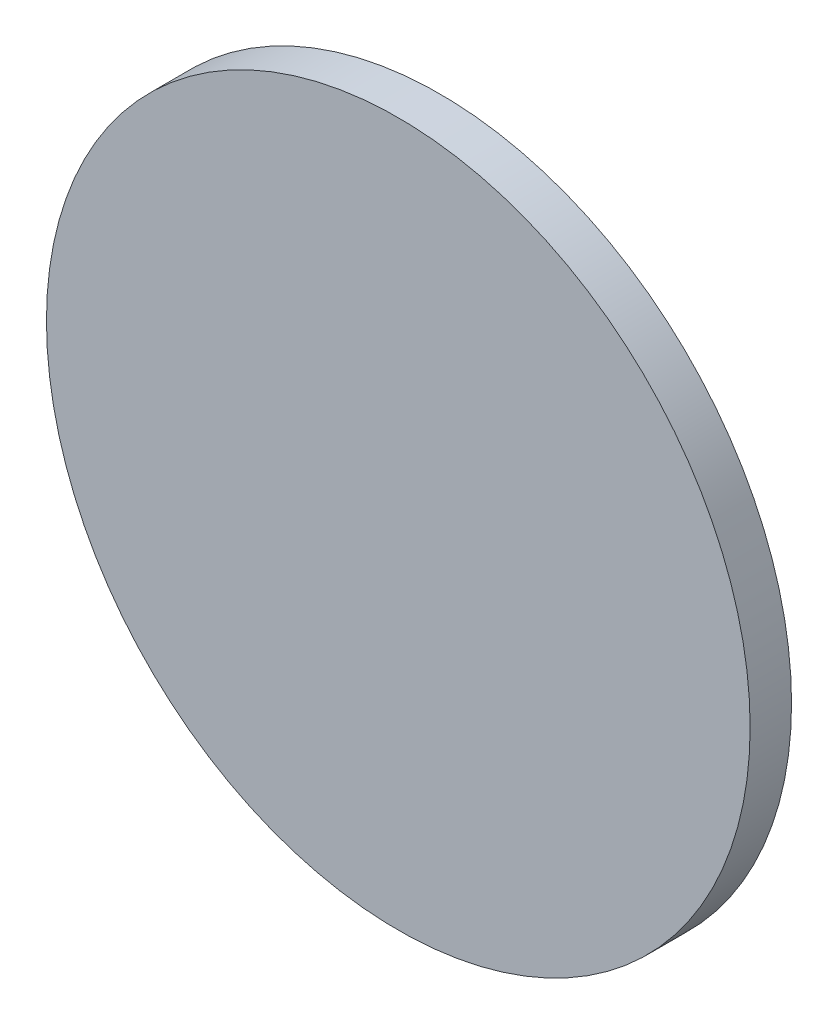
from build123d import *

# Parameters (mm, degrees)
ESQUISSE1_R        = 4.25
BOSS_EXTRU_1_DEPTH = 0.5


with BuildPart() as part:
    # Esquisse1 → Boss.-Extru.1 (new body)
    with BuildSketch(Plane.XY):
        with Locations(Location((24.65, 20, 0), (0, 0, 180))):
            Circle(ESQUISSE1_R)
    extrude(amount=BOSS_EXTRU_1_DEPTH)


solid = part.part
